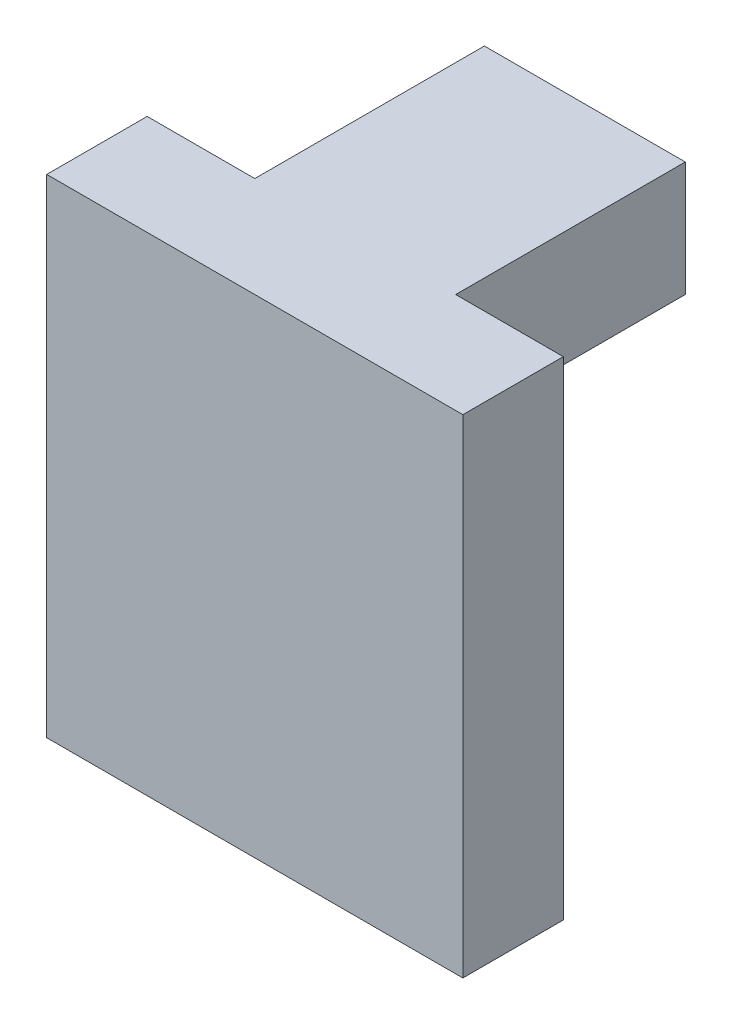
from build123d import *

# Parameters (mm, degrees)
SKETCH_1_W      = 29
SKETCH_1_H      = 34
EXTRUDE_1_DEPTH = 7
SKETCH_3_W      = 14
SKETCH_3_H      = 8
EXTRUDE_2_DEPTH = 16


with BuildPart() as part:
    # 草图1 → 凸台-拉伸1 (new body)
    with BuildSketch(Plane.XY):
        Rectangle(SKETCH_1_W, SKETCH_1_H)
    extrude(amount=EXTRUDE_1_DEPTH)

    # 草图3 → 凸台-拉伸2 (add)
    with BuildSketch(Plane(origin=(0, 0, 0), x_dir=(-1, 0, 0), z_dir=(0, 0, -1))):
        with Locations((0, 13)):
            Rectangle(SKETCH_3_W, SKETCH_3_H)
    extrude(amount=EXTRUDE_2_DEPTH)


solid = part.part
